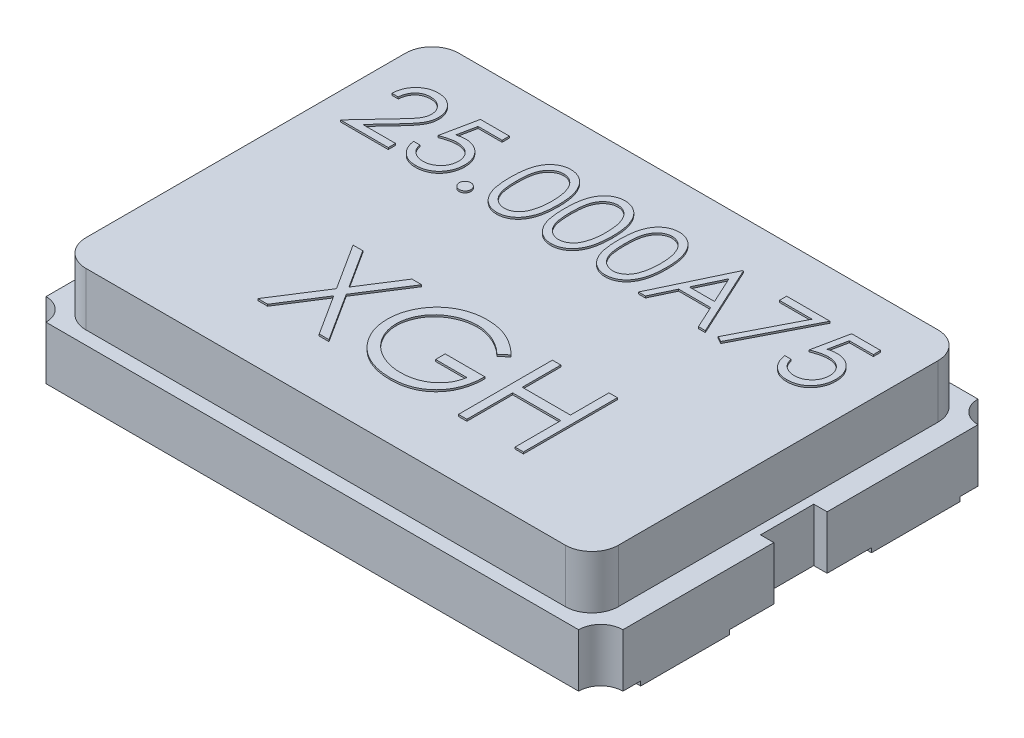
from build123d import *

# Parameters (mm, degrees)
EXTRUDE1_DEPTH = 0.6
EXTRUDE2_DEPTH = 0.6
SKETCH3_W      = 1
SKETCH3_H      = 1
EXTRUDE3_DEPTH = 0.05
EXTRUDE4_DEPTH = 0.02
EXTRUDE5_DEPTH = 0.02


with BuildPart() as part:
    # Sketch1 → Extrude1 (new body)
    with BuildSketch(Plane(origin=(0, 0, 0), x_dir=(1, 0, 0), z_dir=(0, 1, 0))):
        with BuildLine():
            Line((-3.25, 2), (-3.25, 0.3))
            Line((-3.25, 0.3), (-3.1, 0.3))
            Line((-3.1, 0.3), (-3.1, -0.3))
            Line((-3.1, -0.3), (-3.25, -0.3))
            Line((-3.25, -0.3), (-3.25, -2))
            ThreePointArc((-3.25, -2), (-3.073223305, -2.073223305), (-3, -2.25))
            Line((-3, -2.25), (3, -2.25))
            ThreePointArc((3, -2.25), (3.073223305, -2.073223305), (3.25, -2))
            Line((3.25, -2), (3.25, -0.3))
            Line((3.25, -0.3), (3.1, -0.3))
            Line((3.1, -0.3), (3.1, 0.3))
            Line((3.1, 0.3), (3.25, 0.3))
            Line((3.25, 0.3), (3.25, 2))
            ThreePointArc((3.25, 2), (3.073223305, 2.073223305), (3, 2.25))
            Line((3, 2.25), (-3, 2.25))
            ThreePointArc((-3, 2.25), (-3.073223305, 2.073223305), (-3.25, 2))
        make_face()
    extrude(amount=EXTRUDE1_DEPTH)

    # Sketch2 → Extrude2 (add)
    with BuildSketch(Plane(origin=(0, 0.6, 0), x_dir=(1, 0, 0), z_dir=(0, 1, 0))):
        with BuildLine():
            Line((-2.7, 2.1), (2.7, 2.1))
            ThreePointArc((2.7, 2.1), (2.912132034, 2.012132034), (3, 1.8))
            Line((3, 1.8), (3, -1.8))
            ThreePointArc((3, -1.8), (2.912132034, -2.012132034), (2.7, -2.1))
            Line((2.7, -2.1), (-2.7, -2.1))
            ThreePointArc((-2.7, -2.1), (-2.912132034, -2.012132034), (-3, -1.8))
            Line((-3, -1.8), (-3, 1.8))
            ThreePointArc((-3, 1.8), (-2.912132034, 2.012132034), (-2.7, 2.1))
        make_face()
    extrude(amount=EXTRUDE2_DEPTH)

    # Sketch3 → Extrude3 (add)
    with BuildSketch(Plane.XZ):
        with Locations((-2.75, 1.3)):
            Rectangle(SKETCH3_W, SKETCH3_H)
        with Locations((-2.75, -1.3)):
            Rectangle(SKETCH3_W, SKETCH3_H)
        with Locations((2.75, 1.3)):
            Rectangle(SKETCH3_W, SKETCH3_H)
        with Locations((2.75, -1.3)):
            Rectangle(SKETCH3_W, SKETCH3_H)
    extrude(amount=EXTRUDE3_DEPTH)

    # Sketch4 → Extrude4 (add)
    # profile 1 of 9: a face of its own
    with BuildSketch(Plane(origin=(0, 1.2, 0), x_dir=(1, 0, 0), z_dir=(0, 1, 0))):
        with BuildLine():
            Line((-2.593557402, 1.311680884), (-2.664791376, 1.311680884))
            add(Edge.make_bspline(
                [(-2.664791376, 1.311680884), (-2.664327111, 1.321131246), (-2.663415307, 1.339691506), (-2.65914532, 1.366752463), (-2.653035514, 1.392618462), (-2.644396916, 1.417081817), (-2.633668528, 1.440358833), (-2.620802968, 1.46235705), (-2.605564363, 1.482992552), (-2.588281764, 1.50207404), (-2.569511019, 1.519579078), (-2.549257708, 1.534695535), (-2.527974996, 1.547467578), (-2.505727454, 1.558144932), (-2.482264076, 1.566159504), (-2.457797785, 1.572106197), (-2.432221088, 1.575684047), (-2.414794869, 1.576068627), (-2.405932201, 1.576264217)],
                knots=[0, 0, 0, 0, 1.10065271, 2.161652631, 3.183658789, 4.190468796, 5.17591951, 6.163126047, 7.15150782, 8.156236427, 9.156009102, 10.134482811, 11.092018607, 12.041330605, 13.001268258, 13.972401359, 14.968799086, 16, 16, 16, 16], degree=3))
            add(Edge.make_bspline(
                [(-2.405932201, 1.576264217), (-2.397228602, 1.57606046), (-2.380126341, 1.575660085), (-2.355165849, 1.57222178), (-2.331403855, 1.566836619), (-2.308886808, 1.559281159), (-2.287794361, 1.54912469), (-2.267968064, 1.536924177), (-2.24917188, 1.522813608), (-2.232252127, 1.50620069), (-2.216715473, 1.488465506), (-2.203311926, 1.469531642), (-2.191833584, 1.449976072), (-2.182266021, 1.429649676), (-2.175222932, 1.408361068), (-2.169875731, 1.386420185), (-2.166853264, 1.363599915), (-2.166389391, 1.348154321), (-2.166153555, 1.340301677)],
                knots=[0, 0, 0, 0, 1.111607364, 2.184268762, 3.212621178, 4.221274766, 5.211760367, 6.196651075, 7.1921475, 8.207485113, 9.220403448, 10.201281604, 11.166441695, 12.114753415, 13.065576456, 14.026450734, 14.996634279, 16, 16, 16, 16], degree=3))
            add(Edge.make_bspline(
                [(-2.166153555, 1.340301677), (-2.166537563, 1.329246365), (-2.16729884, 1.307329745), (-2.17381085, 1.275122803), (-2.183981399, 1.243918581), (-2.196227228, 1.218804943), (-2.2085808, 1.198568061), (-2.219713145, 1.181906408), (-2.232745344, 1.163966418), (-2.247867074, 1.144808165), (-2.264765529, 1.124281585), (-2.28359377, 1.102399078), (-2.30448606, 1.07938673), (-2.319149684, 1.06366921), (-2.326748007, 1.055524784)],
                knots=[0, 0, 0, 0, 1.184426356, 2.348067706, 3.509069118, 4.696110526, 5.333549288, 6.050745305, 6.844228056, 7.710549037, 8.667450064, 9.695053472, 10.805634456, 12, 12, 12, 12], degree=3))
            Line((-2.326748007, 1.055524784), (-2.525344511, 0.84357191))
            Line((-2.525344511, 0.84357191), (-2.155977273, 0.84357191))
            Line((-2.155977273, 0.84357191), (-2.155977273, 0.762161653))
            Line((-2.155977273, 0.762161653), (-2.695320222, 0.762161653))
            Line((-2.695320222, 0.762161653), (-2.38748769, 1.090664758))
            add(Edge.make_bspline(
                [(-2.38748769, 1.090664758), (-2.379992901, 1.098488481), (-2.365596946, 1.113516252), (-2.345235541, 1.135456174), (-2.32694777, 1.155810087), (-2.310615254, 1.174539537), (-2.296592298, 1.191918481), (-2.28414806, 1.207384066), (-2.274177292, 1.221615879), (-2.263356122, 1.238112411), (-2.252875451, 1.258253776), (-2.243869256, 1.282867666), (-2.238377675, 1.308205811), (-2.237718899, 1.325328594), (-2.23738753, 1.333941501)],
                knots=[0, 0, 0, 0, 1.329631726, 2.553950428, 3.673215718, 4.687767853, 5.603093632, 6.413772471, 7.123043292, 7.734684054, 8.834405432, 9.900288307, 10.943827018, 12, 12, 12, 12], degree=3))
            add(Edge.make_bspline(
                [(-2.23738753, 1.333941501), (-2.237531707, 1.339357461), (-2.237815853, 1.350031278), (-2.240323581, 1.365680798), (-2.244113285, 1.380776747), (-2.249543727, 1.395365559), (-2.256711684, 1.409300555), (-2.265436897, 1.422598698), (-2.275503929, 1.435454946), (-2.287149664, 1.447509354), (-2.299942991, 1.458549556), (-2.313458115, 1.468329483), (-2.327756978, 1.476502638), (-2.342779291, 1.483202681), (-2.358483175, 1.488458527), (-2.374899001, 1.492100383), (-2.391981412, 1.494386946), (-2.403645794, 1.494696321), (-2.409589303, 1.494853961)],
                knots=[0, 0, 0, 0, 0.991446411, 1.95395049, 2.89581595, 3.838931463, 4.798493298, 5.75982156, 6.748411868, 7.785213223, 8.824556874, 9.840280684, 10.836137867, 11.835679398, 12.848801643, 13.863922112, 14.911575587, 16, 16, 16, 16], degree=3))
            add(Edge.make_bspline(
                [(-2.409589303, 1.494853961), (-2.415796616, 1.494691802), (-2.427986756, 1.494373348), (-2.445884465, 1.492145708), (-2.462958204, 1.488302634), (-2.479250921, 1.483046495), (-2.494790185, 1.476365717), (-2.509500423, 1.468044554), (-2.523348614, 1.458115083), (-2.53636079, 1.446857314), (-2.548349585, 1.434323411), (-2.558883073, 1.420351152), (-2.568086948, 1.405195649), (-2.576117256, 1.388897795), (-2.582638636, 1.371309706), (-2.587621832, 1.352493816), (-2.591564921, 1.332531824), (-2.59288221, 1.318746635), (-2.593557402, 1.311680884)],
                knots=[0, 0, 0, 0, 1.031018746, 2.02475058, 2.990194455, 3.934040569, 4.864654155, 5.795059489, 6.735614925, 7.690564532, 8.649604399, 9.611025574, 10.590972636, 11.591080095, 12.624614302, 13.701020113, 14.821632451, 16, 16, 16, 16], degree=3))
        make_face()
    # profile 2 of 9: a face of its own
    with BuildSketch(Plane(origin=(0, 1.2, 0), x_dir=(1, 0, 0), z_dir=(0, 1, 0))):
        with BuildLine():
            Line((-1.586105478, 1.555911653), (-1.586105478, 1.474501397))
            Line((-1.586105478, 1.474501397), (-1.856094962, 1.474501397))
            Line((-1.856094962, 1.474501397), (-1.898867147, 1.26572861))
            add(Edge.make_bspline(
                [(-1.898867147, 1.26572861), (-1.890463404, 1.26804869), (-1.874182481, 1.272543477), (-1.850152299, 1.277534071), (-1.827339424, 1.280542485), (-1.812535902, 1.280953264), (-1.805372556, 1.281152038)],
                knots=[0, 0, 0, 0, 1.100273476, 2.13160584, 3.095893838, 4, 4, 4, 4], degree=3))
            add(Edge.make_bspline(
                [(-1.805372556, 1.281152038), (-1.796508922, 1.280960192), (-1.779080803, 1.280582974), (-1.753581256, 1.276960787), (-1.72923969, 1.271259414), (-1.706107009, 1.263294581), (-1.68414042, 1.253109695), (-1.663542027, 1.24038703), (-1.644002643, 1.225525007), (-1.625872804, 1.208437834), (-1.609425327, 1.189632396), (-1.594964112, 1.169412665), (-1.58268081, 1.147975141), (-1.572801853, 1.125115003), (-1.564913263, 1.101084981), (-1.559662722, 1.075632235), (-1.556166432, 1.048996679), (-1.55577582, 1.03078475), (-1.555576632, 1.021497841)],
                knots=[0, 0, 0, 0, 1.052922333, 2.070308379, 3.05430497, 4.020497103, 4.973039431, 5.925935799, 6.892292201, 7.88610001, 8.88166317, 9.857072816, 10.836096531, 11.812156883, 12.81219415, 13.836441305, 14.89672472, 16, 16, 16, 16], degree=3))
            add(Edge.make_bspline(
                [(-1.555576632, 1.021497841), (-1.555727462, 1.015029409), (-1.556027083, 1.00217996), (-1.557550762, 0.983097257), (-1.560484398, 0.964418543), (-1.56442315, 0.94614134), (-1.569535448, 0.928300251), (-1.575724216, 0.910844208), (-1.583297958, 0.893881859), (-1.59160543, 0.877252707), (-1.600959542, 0.861332689), (-1.611341454, 0.846444436), (-1.622310056, 0.832364608), (-1.634112299, 0.819244208), (-1.646857882, 0.807169452), (-1.660392446, 0.796068681), (-1.674607991, 0.785754165), (-1.689724448, 0.776644592), (-1.705404975, 0.768261922), (-1.721876017, 0.761384977), (-1.73876264, 0.755236696), (-1.756307889, 0.750335964), (-1.774472021, 0.746495903), (-1.793284979, 0.743887731), (-1.812648096, 0.741988075), (-1.825773322, 0.741869158), (-1.832403305, 0.741809089)],
                knots=[0, 0, 0, 0, 1.056347294, 2.098418968, 3.122841568, 4.141288669, 5.149314143, 6.15115421, 7.162517403, 8.180376062, 9.185164535, 10.17417709, 11.141909838, 12.097768115, 13.052685741, 14.0056014, 14.954263652, 15.917497458, 16.885230207, 17.854509472, 18.828990115, 19.81800267, 20.826176721, 21.857883937, 22.917946725, 24, 24, 24, 24], degree=3))
            add(Edge.make_bspline(
                [(-1.832403305, 0.741809089), (-1.840312271, 0.741965761), (-1.855872227, 0.742273995), (-1.878668856, 0.745498545), (-1.900602347, 0.75011679), (-1.921496138, 0.757064658), (-1.941537478, 0.765770348), (-1.960456558, 0.776773123), (-1.978736797, 0.789241598), (-1.995635062, 0.803955535), (-2.011318681, 0.820038199), (-2.025358193, 0.837491093), (-2.0378617, 0.856026163), (-2.048628975, 0.875733423), (-2.057813348, 0.896561089), (-2.065028533, 0.918587199), (-2.070852017, 0.941696664), (-2.073315685, 0.957606478), (-2.074567017, 0.965687294)],
                knots=[0, 0, 0, 0, 1.0467383, 2.05933395, 3.04377827, 4.011590433, 4.970194871, 5.932262533, 6.905835911, 7.896367577, 8.894135286, 9.877477877, 10.858688626, 11.851381753, 12.8477658, 13.868841284, 14.917554742, 16, 16, 16, 16], degree=3))
            Line((-2.074567017, 0.965687294), (-2.003333043, 0.965687294))
            add(Edge.make_bspline(
                [(-2.003333043, 0.965687294), (-2.001580316, 0.958117992), (-1.998211479, 0.943569372), (-1.990816961, 0.923128871), (-1.98177595, 0.904913619), (-1.971025321, 0.88868266), (-1.958200582, 0.874529191), (-1.943566229, 0.861916035), (-1.927158799, 0.850537033), (-1.908926763, 0.841052227), (-1.889692368, 0.832963063), (-1.869561233, 0.827576518), (-1.849081497, 0.823788994), (-1.835229795, 0.823409863), (-1.82826919, 0.823219346)],
                knots=[0, 0, 0, 0, 1.136247022, 2.183929868, 3.172523383, 4.106158343, 5.02341133, 5.958108904, 6.928429099, 7.938127109, 8.96079061, 9.975095812, 10.982467395, 12, 12, 12, 12], degree=3))
            add(Edge.make_bspline(
                [(-1.82826919, 0.823219346), (-1.821475043, 0.823405486), (-1.808097312, 0.823771999), (-1.788409729, 0.826592989), (-1.769402167, 0.830937653), (-1.751262177, 0.837439566), (-1.733672328, 0.84534185), (-1.717077562, 0.855482591), (-1.700997802, 0.867152988), (-1.685932851, 0.880523509), (-1.672135333, 0.895257708), (-1.659944212, 0.911014188), (-1.649789448, 0.92782283), (-1.641231891, 0.945392635), (-1.634733732, 0.963916164), (-1.63009801, 0.98330661), (-1.627375888, 1.003611864), (-1.627001424, 1.017461511), (-1.626810607, 1.024518925)],
                knots=[0, 0, 0, 0, 1.027316725, 2.022795036, 3.002884548, 3.971462791, 4.93288096, 5.914575861, 6.907176829, 7.935150275, 8.956128384, 9.956726525, 10.942570165, 11.921478529, 12.907843606, 13.90538589, 14.932640048, 16, 16, 16, 16], degree=3))
            add(Edge.make_bspline(
                [(-1.626810607, 1.024518925), (-1.62695994, 1.030886104), (-1.62725224, 1.043348952), (-1.629640423, 1.061582343), (-1.633794451, 1.078834623), (-1.639560223, 1.095189101), (-1.646880755, 1.110661203), (-1.655826615, 1.125266897), (-1.666565689, 1.138813677), (-1.678832956, 1.151307881), (-1.692271834, 1.162838772), (-1.707113539, 1.172668592), (-1.723047487, 1.180938087), (-1.7398817, 1.18807458), (-1.758016597, 1.193200106), (-1.777093047, 1.19704818), (-1.79731705, 1.199274164), (-1.811144332, 1.199583021), (-1.818251913, 1.199741781)],
                knots=[0, 0, 0, 0, 1.045622112, 2.046656509, 3.013763289, 3.955457236, 4.890082067, 5.820317437, 6.762574623, 7.722996705, 8.69280354, 9.665887285, 10.63943826, 11.638615906, 12.663482002, 13.728887084, 14.832589034, 16, 16, 16, 16], degree=3))
            add(Edge.make_bspline(
                [(-1.818251913, 1.199741781), (-1.824404366, 1.199610112), (-1.837107622, 1.199338247), (-1.856593691, 1.197336524), (-1.877070564, 1.194107255), (-1.898459745, 1.189665374), (-1.920825467, 1.183852612), (-1.944120533, 1.176887002), (-1.968393922, 1.168558977), (-1.984749192, 1.162269707), (-1.993156761, 1.159036653)],
                knots=[0, 0, 0, 0, 0.817624296, 1.688186739, 2.600797293, 3.572016777, 4.590301741, 5.671205678, 6.80286297, 8, 8, 8, 8], degree=3))
            Line((-1.993156761, 1.159036653), (-1.911746504, 1.555911653))
            Line((-1.911746504, 1.555911653), (-1.586105478, 1.555911653))
        make_face()
    # profile 3 of 9: a face of its own
    with BuildSketch(Plane(origin=(0, 1.2, 0), x_dir=(1, 0, 0), z_dir=(0, 1, 0))):
        with BuildLine():
            add(Edge.make_bspline(
                [(-1.34696285, 0.884277038), (-1.342542749, 0.884014382), (-1.333877656, 0.883499476), (-1.321350211, 0.879966909), (-1.310012136, 0.87369432), (-1.299912859, 0.865334369), (-1.291588355, 0.855198031), (-1.285092225, 0.843950387), (-1.28159043, 0.831318062), (-1.281079275, 0.822602761), (-1.280817017, 0.818131205)],
                knots=[0, 0, 0, 0, 1.020151414, 1.999887582, 2.974338812, 3.990962822, 5.007586832, 5.987933904, 6.967670073, 8, 8, 8, 8], degree=3))
            add(Edge.make_bspline(
                [(-1.280817017, 0.818131205), (-1.281088162, 0.813767092), (-1.281622856, 0.805161127), (-1.285084198, 0.792624081), (-1.291637863, 0.781369408), (-1.299855442, 0.77109553), (-1.310014633, 0.762717868), (-1.321377016, 0.756498646), (-1.333848248, 0.752713143), (-1.342537842, 0.752230929), (-1.34696285, 0.751985371)],
                knots=[0, 0, 0, 0, 1.009421747, 1.99056486, 2.972319754, 3.999869655, 5.017953583, 5.993804169, 6.978383603, 8, 8, 8, 8], degree=3))
            add(Edge.make_bspline(
                [(-1.34696285, 0.751985371), (-1.351391047, 0.752222044), (-1.360036046, 0.752684092), (-1.372460727, 0.756576371), (-1.383892307, 0.762659549), (-1.394049521, 0.771111151), (-1.402335924, 0.781316541), (-1.408600966, 0.792701591), (-1.412363375, 0.805125239), (-1.412858192, 0.813760024), (-1.413108684, 0.818131205)],
                knots=[0, 0, 0, 0, 1.022052826, 1.995314843, 2.982371812, 4.00089066, 5.028879526, 6.005146991, 6.990147033, 8, 8, 8, 8], degree=3))
            add(Edge.make_bspline(
                [(-1.413108684, 0.818131205), (-1.412867815, 0.822610082), (-1.412397548, 0.83135454), (-1.408593068, 0.843872909), (-1.402384534, 0.855250394), (-1.393992239, 0.865318904), (-1.383894765, 0.873752453), (-1.372488304, 0.879890362), (-1.360006122, 0.883528098), (-1.351386011, 0.884023062), (-1.34696285, 0.884277038)],
                knots=[0, 0, 0, 0, 1.032775665, 2.016367738, 2.991239715, 4.008302682, 5.025365648, 6.011011707, 6.979408107, 8, 8, 8, 8], degree=3))
        make_face()
    # profile 4 of 9: a face of its own
    with BuildSketch(Plane(origin=(0, 1.2, 0), x_dir=(1, 0, 0), z_dir=(0, 1, 0))):
        with BuildLine():
            add(Edge.make_bspline(
                [(-1.179054196, 1.158718644), (-1.178979807, 1.171440731), (-1.178835303, 1.196153566), (-1.177227751, 1.232163655), (-1.174557271, 1.26594572), (-1.170897546, 1.29750138), (-1.166443932, 1.32683878), (-1.160498634, 1.35387952), (-1.153737517, 1.378748752), (-1.145901516, 1.401527574), (-1.137059642, 1.422522874), (-1.127436158, 1.442122875), (-1.116649142, 1.46029792), (-1.105315092, 1.477338098), (-1.092975212, 1.492964472), (-1.079980664, 1.507397718), (-1.065824275, 1.520304263), (-1.050987271, 1.532062264), (-1.035335323, 1.542369555), (-1.019314575, 1.551448408), (-1.002814757, 1.55920445), (-0.985790819, 1.565302816), (-0.968395774, 1.570339919), (-0.950568815, 1.573784555), (-0.932280505, 1.575951926), (-0.919936233, 1.576159133), (-0.913675841, 1.576264217)],
                knots=[0, 0, 0, 0, 1.646270934, 3.197905019, 4.663502075, 6.030701355, 7.308322542, 8.50163776, 9.611534131, 10.641858119, 11.616356847, 12.558055219, 13.465016945, 14.349605745, 15.204443733, 16.039544428, 16.859896111, 17.680448484, 18.487036065, 19.28249412, 20.06191084, 20.843045899, 21.620316918, 22.403196591, 23.190181807, 24, 24, 24, 24], degree=3))
            add(Edge.make_bspline(
                [(-0.913675841, 1.576264217), (-0.907363152, 1.576153588), (-0.8948092, 1.575933581), (-0.876248972, 1.573819044), (-0.858117527, 1.570310414), (-0.840492163, 1.56533905), (-0.823228104, 1.559171459), (-0.806460382, 1.551440988), (-0.790084848, 1.542442388), (-0.774361729, 1.531868758), (-0.759118415, 1.520079921), (-0.744729323, 1.506753387), (-0.731193145, 1.492023718), (-0.718339995, 1.47604851), (-0.706534529, 1.458521357), (-0.695291983, 1.439747103), (-0.685229039, 1.419397425), (-0.675537425, 1.397811855), (-0.667171984, 1.374393132), (-0.659627674, 1.349273267), (-0.653531908, 1.322155549), (-0.648454341, 1.293182258), (-0.644520767, 1.262246989), (-0.641655864, 1.229416057), (-0.640142503, 1.194667861), (-0.639857502, 1.170910278), (-0.639711248, 1.158718644)],
                knots=[0, 0, 0, 0, 0.810914788, 1.612654377, 2.396697861, 3.181598691, 3.963628158, 4.749916497, 5.551656086, 6.361998678, 7.18212741, 8.025565596, 8.878627764, 9.750805457, 10.657531673, 11.591944965, 12.560506719, 13.57287815, 14.630710178, 15.753379473, 16.941251878, 18.199788006, 19.531962791, 20.947069417, 22.433333509, 24, 24, 24, 24], degree=3))
            add(Edge.make_bspline(
                [(-0.639711248, 1.158718644), (-0.639859018, 1.146580187), (-0.640146942, 1.122928897), (-0.641638898, 1.088337051), (-0.644577731, 1.055680352), (-0.648253925, 1.024880479), (-0.653345482, 0.996065626), (-0.65960594, 0.969136081), (-0.666556995, 0.943975551), (-0.675137386, 0.920790156), (-0.684528743, 0.899256462), (-0.694746618, 0.879148019), (-0.705693525, 0.860287092), (-0.717619901, 0.84282465), (-0.730332015, 0.82663699), (-0.744101942, 0.81200985), (-0.758541521, 0.798590787), (-0.773829694, 0.78665015), (-0.789798028, 0.776198775), (-0.806117318, 0.766852063), (-0.823077121, 0.759315362), (-0.840293095, 0.752844022), (-0.858011492, 0.747899991), (-0.876210227, 0.744481456), (-0.89479673, 0.742083912), (-0.907361014, 0.741901014), (-0.913675841, 0.741809089)],
                knots=[0, 0, 0, 0, 1.561518951, 3.042555995, 4.452378317, 5.7783523, 7.031515105, 8.214008947, 9.334062868, 10.386615937, 11.391082383, 12.354592575, 13.286541444, 14.194233754, 15.072674879, 15.931287219, 16.775624067, 17.606195743, 18.42308326, 19.229000347, 20.022332153, 20.807536673, 21.593273796, 22.3848459, 23.188221202, 24, 24, 24, 24], degree=3))
            add(Edge.make_bspline(
                [(-0.913675841, 0.741809089), (-0.91993606, 0.741914852), (-0.932279989, 0.742123395), (-0.950570807, 0.744280974), (-0.968324147, 0.747749775), (-0.985627614, 0.752606755), (-1.002569985, 0.758551906), (-1.018920393, 0.766297473), (-1.034860635, 0.775217878), (-1.050348184, 0.78537684), (-1.065092014, 0.797015864), (-1.07917509, 0.809889194), (-1.092243622, 0.824318075), (-1.104407068, 0.840074675), (-1.115967263, 0.857014036), (-1.126601103, 0.875367434), (-1.136436993, 0.895062098), (-1.145427571, 0.916225267), (-1.153398785, 0.93916576), (-1.160439962, 0.96414602), (-1.165999423, 0.99138653), (-1.170758057, 1.020668504), (-1.174596266, 1.052117771), (-1.177216622, 1.085751402), (-1.17883617, 1.121548441), (-1.178980195, 1.146102479), (-1.179054196, 1.158718644)],
                knots=[0, 0, 0, 0, 0.810891512, 1.598919785, 2.382837074, 3.152667961, 3.926044502, 4.706494248, 5.493654104, 6.291793342, 7.103789334, 7.925228297, 8.761435821, 9.622817696, 10.50288917, 11.416980706, 12.369136599, 13.353924996, 14.394355917, 15.514179734, 16.714354668, 17.994756427, 19.357759367, 20.818452758, 22.365282078, 24, 24, 24, 24], degree=3))
        make_face()
        with BuildLine():
            add(Edge.make_bspline(
                [(-1.107820222, 1.159036653), (-1.107793133, 1.148434716), (-1.107740559, 1.127858438), (-1.106367099, 1.09795827), (-1.104496064, 1.070070356), (-1.10208277, 1.044159286), (-1.098498887, 1.020312766), (-1.094483241, 0.998366784), (-1.089596442, 0.978437482), (-1.083814536, 0.960388103), (-1.077228884, 0.943912333), (-1.070038447, 0.928581343), (-1.062313961, 0.914214029), (-1.053669083, 0.900939442), (-1.044254059, 0.888714294), (-1.034281552, 0.877322206), (-1.023379377, 0.86716289), (-1.008297278, 0.854978407), (-0.988386292, 0.842387461), (-0.963299153, 0.831423258), (-0.937520772, 0.824532951), (-0.920023971, 0.823656706), (-0.911290775, 0.823219346)],
                knots=[0, 0, 0, 0, 1.459021318, 2.831673884, 4.118529203, 5.306027144, 6.411944654, 7.436330062, 8.375795394, 9.233974572, 10.042671642, 10.816086306, 11.563610507, 12.285937304, 12.993564865, 13.685989202, 14.367179055, 15.041617293, 16.353048772, 17.594441528, 18.799311195, 20, 20, 20, 20], degree=3))
            add(Edge.make_bspline(
                [(-0.911290775, 0.823219346), (-0.902501089, 0.823581699), (-0.884939864, 0.824305659), (-0.859282735, 0.831290373), (-0.834374799, 0.841829), (-0.814854912, 0.85429031), (-0.800004407, 0.866157627), (-0.789364304, 0.876275592), (-0.779598446, 0.887604869), (-0.770336047, 0.899828459), (-0.761840864, 0.913179898), (-0.754115831, 0.927594982), (-0.747066572, 0.943113742), (-0.743050413, 0.953947236), (-0.740997055, 0.959486122)],
                knots=[0, 0, 0, 0, 1.353760809, 2.704726607, 4.075137775, 5.516104923, 6.260822281, 7.007110065, 7.778089737, 8.566572457, 9.372053459, 10.217411131, 11.088608312, 12, 12, 12, 12], degree=3))
            add(Edge.make_bspline(
                [(-0.740997055, 0.959486122), (-0.738604065, 0.966568581), (-0.733745268, 0.98094901), (-0.727483313, 1.003256481), (-0.722551767, 1.026661393), (-0.718115075, 1.051023875), (-0.715086792, 1.076523593), (-0.712649342, 1.103081648), (-0.711213633, 1.130718064), (-0.711035662, 1.149494785), (-0.710945222, 1.159036653)],
                knots=[0, 0, 0, 0, 0.884706709, 1.796334032, 2.740027952, 3.714592787, 4.726048262, 5.777819803, 6.87074269, 8, 8, 8, 8], degree=3))
            add(Edge.make_bspline(
                [(-0.710945222, 1.159036653), (-0.711069997, 1.168576978), (-0.711314084, 1.187239892), (-0.712247077, 1.214571694), (-0.714656352, 1.240531346), (-0.717332224, 1.265230686), (-0.721277665, 1.288532987), (-0.725531668, 1.310633324), (-0.731246943, 1.331257903), (-0.737351963, 1.350729629), (-0.744339321, 1.368827278), (-0.752030925, 1.385635226), (-0.760245502, 1.401234618), (-0.76916776, 1.415582657), (-0.778691781, 1.428743609), (-0.78906894, 1.440453597), (-0.79988761, 1.451075552), (-0.815040793, 1.463200099), (-0.834878713, 1.475562573), (-0.85956335, 1.486939451), (-0.885251514, 1.49347276), (-0.90261728, 1.494393893), (-0.911290775, 1.494853961)],
                knots=[0, 0, 0, 0, 1.31362396, 2.569729283, 3.763502607, 4.902122613, 5.988968491, 7.01645872, 7.998833611, 8.933434873, 9.825090667, 10.667526885, 11.477055099, 12.250526234, 12.991942729, 13.710640831, 14.402115721, 15.076753259, 16.378508321, 17.609869233, 18.806226677, 20, 20, 20, 20], degree=3))
            add(Edge.make_bspline(
                [(-0.911290775, 1.494853961), (-0.920069784, 1.494393258), (-0.937643796, 1.493471012), (-0.963598957, 1.486963792), (-0.988478337, 1.475621566), (-1.008263797, 1.463159153), (-1.023427549, 1.451289572), (-1.034105231, 1.440996572), (-1.044116952, 1.429737511), (-1.053339806, 1.417399934), (-1.061977911, 1.404140824), (-1.069911105, 1.389855872), (-1.077058785, 1.374472688), (-1.083654742, 1.358004317), (-1.089454285, 1.339956496), (-1.094238095, 1.320051742), (-1.09865748, 1.298175563), (-1.10178605, 1.274199889), (-1.104567295, 1.248282329), (-1.106354672, 1.220324795), (-1.107745153, 1.19037448), (-1.107794698, 1.169691813), (-1.107820222, 1.159036653)],
                knots=[0, 0, 0, 0, 1.207732386, 2.417664972, 3.655092373, 4.956220595, 5.625982001, 6.301752483, 6.994047911, 7.697131622, 8.419323945, 9.170223765, 9.943494443, 10.752040957, 11.610060368, 12.549350801, 13.567764191, 14.679664412, 15.874934091, 17.154273443, 18.533957287, 20, 20, 20, 20], degree=3))
        make_face(mode=Mode.SUBTRACT)
    # profile 5 of 9: a face of its own
    with BuildSketch(Plane(origin=(0, 1.2, 0), x_dir=(1, 0, 0), z_dir=(0, 1, 0))):
        with BuildLine():
            add(Edge.make_bspline(
                [(-0.568477273, 1.158718644), (-0.568402884, 1.171440731), (-0.56825838, 1.196153566), (-0.566650828, 1.232163655), (-0.563980348, 1.26594572), (-0.560320623, 1.29750138), (-0.555867009, 1.32683878), (-0.549921711, 1.35387952), (-0.543160594, 1.378748752), (-0.535324592, 1.401527574), (-0.526482719, 1.422522874), (-0.516859235, 1.442122875), (-0.506072219, 1.46029792), (-0.494738169, 1.477338098), (-0.482398288, 1.492964472), (-0.469403741, 1.507397718), (-0.455247352, 1.520304263), (-0.440410348, 1.532062264), (-0.4247584, 1.542369555), (-0.408737652, 1.551448408), (-0.392237834, 1.55920445), (-0.375213896, 1.565302816), (-0.357818851, 1.570339919), (-0.339991892, 1.573784555), (-0.321703582, 1.575951926), (-0.30935931, 1.576159133), (-0.303098918, 1.576264217)],
                knots=[0, 0, 0, 0, 1.646270934, 3.197905019, 4.663502075, 6.030701355, 7.308322542, 8.50163776, 9.611534131, 10.641858119, 11.616356847, 12.558055219, 13.465016945, 14.349605745, 15.204443733, 16.039544428, 16.859896111, 17.680448484, 18.487036065, 19.28249412, 20.06191084, 20.843045899, 21.620316918, 22.403196591, 23.190181807, 24, 24, 24, 24], degree=3))
            add(Edge.make_bspline(
                [(-0.303098918, 1.576264217), (-0.296786229, 1.576153588), (-0.284232277, 1.575933581), (-0.265672049, 1.573819044), (-0.247540603, 1.570310414), (-0.22991524, 1.56533905), (-0.21265118, 1.559171459), (-0.195883459, 1.551440988), (-0.179507925, 1.542442388), (-0.163784806, 1.531868758), (-0.148541492, 1.520079921), (-0.1341524, 1.506753387), (-0.120616221, 1.492023718), (-0.107763072, 1.47604851), (-0.095957606, 1.458521357), (-0.08471506, 1.439747103), (-0.074652116, 1.419397425), (-0.064960502, 1.397811855), (-0.056595061, 1.374393132), (-0.049050751, 1.349273267), (-0.042954985, 1.322155549), (-0.037877418, 1.293182258), (-0.033943844, 1.262246989), (-0.031078941, 1.229416057), (-0.02956558, 1.194667861), (-0.029280579, 1.170910278), (-0.029134325, 1.158718644)],
                knots=[0, 0, 0, 0, 0.810914788, 1.612654377, 2.396697861, 3.181598691, 3.963628158, 4.749916497, 5.551656086, 6.361998678, 7.18212741, 8.025565596, 8.878627764, 9.750805457, 10.657531673, 11.591944965, 12.560506719, 13.57287815, 14.630710178, 15.753379473, 16.941251878, 18.199788006, 19.531962791, 20.947069417, 22.433333509, 24, 24, 24, 24], degree=3))
            add(Edge.make_bspline(
                [(-0.029134325, 1.158718644), (-0.029282095, 1.146580187), (-0.029570019, 1.122928897), (-0.031061975, 1.088337051), (-0.034000808, 1.055680352), (-0.037677002, 1.024880479), (-0.042768559, 0.996065626), (-0.049029017, 0.969136081), (-0.055980072, 0.943975551), (-0.064560463, 0.920790156), (-0.07395182, 0.899256462), (-0.084169695, 0.879148019), (-0.095116602, 0.860287092), (-0.107042978, 0.84282465), (-0.119755092, 0.82663699), (-0.133525019, 0.81200985), (-0.147964598, 0.798590787), (-0.163252771, 0.78665015), (-0.179221105, 0.776198775), (-0.195540395, 0.766852063), (-0.212500198, 0.759315362), (-0.229716171, 0.752844022), (-0.247434569, 0.747899991), (-0.265633304, 0.744481456), (-0.284219807, 0.742083912), (-0.296784091, 0.741901014), (-0.303098918, 0.741809089)],
                knots=[0, 0, 0, 0, 1.561518951, 3.042555995, 4.452378317, 5.7783523, 7.031515105, 8.214008947, 9.334062868, 10.386615937, 11.391082383, 12.354592575, 13.286541444, 14.194233754, 15.072674879, 15.931287219, 16.775624067, 17.606195743, 18.42308326, 19.229000347, 20.022332153, 20.807536673, 21.593273796, 22.3848459, 23.188221202, 24, 24, 24, 24], degree=3))
            add(Edge.make_bspline(
                [(-0.303098918, 0.741809089), (-0.309359137, 0.741914852), (-0.321703066, 0.742123395), (-0.339993884, 0.744280974), (-0.357747224, 0.747749775), (-0.375050691, 0.752606755), (-0.391993062, 0.758551906), (-0.40834347, 0.766297473), (-0.424283712, 0.775217878), (-0.439771261, 0.78537684), (-0.454515091, 0.797015864), (-0.468598167, 0.809889194), (-0.481666698, 0.824318075), (-0.493830145, 0.840074675), (-0.50539034, 0.857014036), (-0.51602418, 0.875367434), (-0.52586007, 0.895062098), (-0.534850648, 0.916225267), (-0.542821862, 0.93916576), (-0.549863039, 0.96414602), (-0.5554225, 0.99138653), (-0.560181134, 1.020668504), (-0.564019343, 1.052117771), (-0.566639698, 1.085751402), (-0.568259247, 1.121548441), (-0.568403272, 1.146102479), (-0.568477273, 1.158718644)],
                knots=[0, 0, 0, 0, 0.810891512, 1.598919785, 2.382837074, 3.152667961, 3.926044502, 4.706494248, 5.493654104, 6.291793342, 7.103789334, 7.925228297, 8.761435821, 9.622817696, 10.50288917, 11.416980706, 12.369136599, 13.353924996, 14.394355917, 15.514179734, 16.714354668, 17.994756427, 19.357759367, 20.818452758, 22.365282078, 24, 24, 24, 24], degree=3))
        make_face()
        with BuildLine():
            add(Edge.make_bspline(
                [(-0.497243299, 1.159036653), (-0.49721621, 1.148434716), (-0.497163636, 1.127858438), (-0.495790176, 1.09795827), (-0.493919141, 1.070070356), (-0.491505847, 1.044159286), (-0.487921964, 1.020312766), (-0.483906318, 0.998366784), (-0.479019519, 0.978437482), (-0.473237613, 0.960388103), (-0.466651961, 0.943912333), (-0.459461524, 0.928581343), (-0.451737038, 0.914214029), (-0.44309216, 0.900939442), (-0.433677136, 0.888714294), (-0.423704629, 0.877322206), (-0.412802454, 0.86716289), (-0.397720355, 0.854978407), (-0.377809369, 0.842387461), (-0.35272223, 0.831423258), (-0.326943849, 0.824532951), (-0.309447048, 0.823656706), (-0.300713852, 0.823219346)],
                knots=[0, 0, 0, 0, 1.459021318, 2.831673884, 4.118529203, 5.306027144, 6.411944654, 7.436330062, 8.375795394, 9.233974572, 10.042671642, 10.816086306, 11.563610507, 12.285937304, 12.993564865, 13.685989202, 14.367179055, 15.041617293, 16.353048772, 17.594441528, 18.799311195, 20, 20, 20, 20], degree=3))
            add(Edge.make_bspline(
                [(-0.300713852, 0.823219346), (-0.291924166, 0.823581699), (-0.274362941, 0.824305659), (-0.248705812, 0.831290373), (-0.223797876, 0.841829), (-0.204277989, 0.85429031), (-0.189427484, 0.866157627), (-0.178787381, 0.876275592), (-0.169021523, 0.887604869), (-0.159759124, 0.899828459), (-0.151263941, 0.913179898), (-0.143538908, 0.927594982), (-0.136489649, 0.943113742), (-0.13247349, 0.953947236), (-0.130420132, 0.959486122)],
                knots=[0, 0, 0, 0, 1.353760809, 2.704726607, 4.075137775, 5.516104923, 6.260822281, 7.007110065, 7.778089737, 8.566572457, 9.372053459, 10.217411131, 11.088608312, 12, 12, 12, 12], degree=3))
            add(Edge.make_bspline(
                [(-0.130420132, 0.959486122), (-0.128027142, 0.966568581), (-0.123168345, 0.98094901), (-0.116906389, 1.003256481), (-0.111974844, 1.026661393), (-0.107538152, 1.051023875), (-0.104509869, 1.076523593), (-0.102072419, 1.103081648), (-0.100636709, 1.130718064), (-0.100458739, 1.149494785), (-0.100368299, 1.159036653)],
                knots=[0, 0, 0, 0, 0.884706709, 1.796334032, 2.740027952, 3.714592787, 4.726048262, 5.777819803, 6.87074269, 8, 8, 8, 8], degree=3))
            add(Edge.make_bspline(
                [(-0.100368299, 1.159036653), (-0.100493074, 1.168576978), (-0.100737161, 1.187239892), (-0.101670154, 1.214571694), (-0.104079429, 1.240531346), (-0.106755301, 1.265230686), (-0.110700742, 1.288532987), (-0.114954745, 1.310633324), (-0.12067002, 1.331257903), (-0.12677504, 1.350729629), (-0.133762398, 1.368827278), (-0.141454002, 1.385635226), (-0.149668579, 1.401234618), (-0.158590837, 1.415582657), (-0.168114858, 1.428743609), (-0.178492017, 1.440453597), (-0.189310687, 1.451075552), (-0.20446387, 1.463200099), (-0.224301789, 1.475562573), (-0.248986427, 1.486939451), (-0.274674591, 1.49347276), (-0.292040357, 1.494393893), (-0.300713852, 1.494853961)],
                knots=[0, 0, 0, 0, 1.31362396, 2.569729283, 3.763502607, 4.902122613, 5.988968491, 7.01645872, 7.998833611, 8.933434873, 9.825090667, 10.667526885, 11.477055099, 12.250526234, 12.991942729, 13.710640831, 14.402115721, 15.076753259, 16.378508321, 17.609869233, 18.806226677, 20, 20, 20, 20], degree=3))
            add(Edge.make_bspline(
                [(-0.300713852, 1.494853961), (-0.309492861, 1.494393258), (-0.327066873, 1.493471012), (-0.353022034, 1.486963792), (-0.377901414, 1.475621566), (-0.397686874, 1.463159153), (-0.412850626, 1.451289572), (-0.423528308, 1.440996572), (-0.433540029, 1.429737511), (-0.442762883, 1.417399934), (-0.451400988, 1.404140824), (-0.459334182, 1.389855872), (-0.466481862, 1.374472688), (-0.473077819, 1.358004317), (-0.478877362, 1.339956496), (-0.483661172, 1.320051742), (-0.488080557, 1.298175563), (-0.491209127, 1.274199889), (-0.493990372, 1.248282329), (-0.495777749, 1.220324795), (-0.49716823, 1.19037448), (-0.497217775, 1.169691813), (-0.497243299, 1.159036653)],
                knots=[0, 0, 0, 0, 1.207732386, 2.417664972, 3.655092373, 4.956220595, 5.625982001, 6.301752483, 6.994047911, 7.697131622, 8.419323945, 9.170223765, 9.943494443, 10.752040957, 11.610060368, 12.549350801, 13.567764191, 14.679664412, 15.874934091, 17.154273443, 18.533957287, 20, 20, 20, 20], degree=3))
        make_face(mode=Mode.SUBTRACT)
    # profile 6 of 9: a face of its own
    with BuildSketch(Plane(origin=(0, 1.2, 0), x_dir=(1, 0, 0), z_dir=(0, 1, 0))):
        with BuildLine():
            add(Edge.make_bspline(
                [(0.04209965, 1.158718644), (0.04217404, 1.171440731), (0.042318543, 1.196153566), (0.043926095, 1.232163655), (0.046596575, 1.26594572), (0.050256301, 1.29750138), (0.054709914, 1.32683878), (0.060655212, 1.35387952), (0.067416329, 1.378748752), (0.075252331, 1.401527574), (0.084094204, 1.422522874), (0.093717688, 1.442122875), (0.104504704, 1.46029792), (0.115838754, 1.477338098), (0.128178635, 1.492964472), (0.141173182, 1.507397718), (0.155329572, 1.520304263), (0.170166575, 1.532062264), (0.185818523, 1.542369555), (0.201839271, 1.551448408), (0.21833909, 1.55920445), (0.235363027, 1.565302816), (0.252758072, 1.570339919), (0.270585032, 1.573784555), (0.288873341, 1.575951926), (0.301217613, 1.576159133), (0.307478005, 1.576264217)],
                knots=[0, 0, 0, 0, 1.646270934, 3.197905019, 4.663502075, 6.030701355, 7.308322542, 8.50163776, 9.611534131, 10.641858119, 11.616356847, 12.558055219, 13.465016945, 14.349605745, 15.204443733, 16.039544428, 16.859896111, 17.680448484, 18.487036065, 19.28249412, 20.06191084, 20.843045899, 21.620316918, 22.403196591, 23.190181807, 24, 24, 24, 24], degree=3))
            add(Edge.make_bspline(
                [(0.307478005, 1.576264217), (0.313790694, 1.576153588), (0.326344646, 1.575933581), (0.344904874, 1.573819044), (0.36303632, 1.570310414), (0.380661683, 1.56533905), (0.397925743, 1.559171459), (0.414693464, 1.551440988), (0.431068998, 1.542442388), (0.446792117, 1.531868758), (0.462035432, 1.520079921), (0.476424523, 1.506753387), (0.489960702, 1.492023718), (0.502813851, 1.47604851), (0.514619317, 1.458521357), (0.525861863, 1.439747103), (0.535924807, 1.419397425), (0.545616421, 1.397811855), (0.553981863, 1.374393132), (0.561526172, 1.349273267), (0.567621938, 1.322155549), (0.572699505, 1.293182258), (0.57663308, 1.262246989), (0.579497982, 1.229416057), (0.581011343, 1.194667861), (0.581296345, 1.170910278), (0.581442598, 1.158718644)],
                knots=[0, 0, 0, 0, 0.810914788, 1.612654377, 2.396697861, 3.181598691, 3.963628158, 4.749916497, 5.551656086, 6.361998678, 7.18212741, 8.025565596, 8.878627764, 9.750805457, 10.657531673, 11.591944965, 12.560506719, 13.57287815, 14.630710178, 15.753379473, 16.941251878, 18.199788006, 19.531962791, 20.947069417, 22.433333509, 24, 24, 24, 24], degree=3))
            add(Edge.make_bspline(
                [(0.581442598, 1.158718644), (0.581294828, 1.146580187), (0.581006904, 1.122928897), (0.579514948, 1.088337051), (0.576576115, 1.055680352), (0.572899922, 1.024880479), (0.567808364, 0.996065626), (0.561547906, 0.969136081), (0.554596851, 0.943975551), (0.54601646, 0.920790156), (0.536625103, 0.899256462), (0.526407228, 0.879148019), (0.515460321, 0.860287092), (0.503533945, 0.84282465), (0.490821832, 0.82663699), (0.477051904, 0.81200985), (0.462612325, 0.798590787), (0.447324152, 0.78665015), (0.431355818, 0.776198775), (0.415036528, 0.766852063), (0.398076725, 0.759315362), (0.380860752, 0.752844022), (0.363142354, 0.747899991), (0.344943619, 0.744481456), (0.326357116, 0.742083912), (0.313792832, 0.741901014), (0.307478005, 0.741809089)],
                knots=[0, 0, 0, 0, 1.561518951, 3.042555995, 4.452378317, 5.7783523, 7.031515105, 8.214008947, 9.334062868, 10.386615937, 11.391082383, 12.354592575, 13.286541444, 14.194233754, 15.072674879, 15.931287219, 16.775624067, 17.606195743, 18.42308326, 19.229000347, 20.022332153, 20.807536673, 21.593273796, 22.3848459, 23.188221202, 24, 24, 24, 24], degree=3))
            add(Edge.make_bspline(
                [(0.307478005, 0.741809089), (0.301217786, 0.741914852), (0.288873857, 0.742123395), (0.270583039, 0.744280974), (0.252829699, 0.747749775), (0.235526232, 0.752606755), (0.218583861, 0.758551906), (0.202233454, 0.766297473), (0.186293211, 0.775217878), (0.170805662, 0.78537684), (0.156061832, 0.797015864), (0.141978756, 0.809889194), (0.128910225, 0.824318075), (0.116746778, 0.840074675), (0.105186583, 0.857014036), (0.094552743, 0.875367434), (0.084716853, 0.895062098), (0.075726275, 0.916225267), (0.067755061, 0.93916576), (0.060713884, 0.96414602), (0.055154423, 0.99138653), (0.050395789, 1.020668504), (0.046557581, 1.052117771), (0.043937225, 1.085751402), (0.042317676, 1.121548441), (0.042173651, 1.146102479), (0.04209965, 1.158718644)],
                knots=[0, 0, 0, 0, 0.810891512, 1.598919785, 2.382837074, 3.152667961, 3.926044502, 4.706494248, 5.493654104, 6.291793342, 7.103789334, 7.925228297, 8.761435821, 9.622817696, 10.50288917, 11.416980706, 12.369136599, 13.353924996, 14.394355917, 15.514179734, 16.714354668, 17.994756427, 19.357759367, 20.818452758, 22.365282078, 24, 24, 24, 24], degree=3))
        make_face()
        with BuildLine():
            add(Edge.make_bspline(
                [(0.113333624, 1.159036653), (0.113360713, 1.148434716), (0.113413287, 1.127858438), (0.114786747, 1.09795827), (0.116657782, 1.070070356), (0.119071076, 1.044159286), (0.122654959, 1.020312766), (0.126670605, 0.998366784), (0.131557404, 0.978437482), (0.13733931, 0.960388103), (0.143924962, 0.943912333), (0.151115399, 0.928581343), (0.158839885, 0.914214029), (0.167484764, 0.900939442), (0.176899787, 0.888714294), (0.186872294, 0.877322206), (0.197774469, 0.86716289), (0.212856568, 0.854978407), (0.232767554, 0.842387461), (0.257854693, 0.831423258), (0.283633074, 0.824532951), (0.301129875, 0.823656706), (0.309863071, 0.823219346)],
                knots=[0, 0, 0, 0, 1.459021318, 2.831673884, 4.118529203, 5.306027144, 6.411944654, 7.436330062, 8.375795394, 9.233974572, 10.042671642, 10.816086306, 11.563610507, 12.285937304, 12.993564865, 13.685989202, 14.367179055, 15.041617293, 16.353048772, 17.594441528, 18.799311195, 20, 20, 20, 20], degree=3))
            add(Edge.make_bspline(
                [(0.309863071, 0.823219346), (0.318652757, 0.823581699), (0.336213983, 0.824305659), (0.361871111, 0.831290373), (0.386779047, 0.841829), (0.406298934, 0.85429031), (0.421149439, 0.866157627), (0.431789542, 0.876275592), (0.4415554, 0.887604869), (0.450817799, 0.899828459), (0.459312982, 0.913179898), (0.467038015, 0.927594982), (0.474087274, 0.943113742), (0.478103433, 0.953947236), (0.480156791, 0.959486122)],
                knots=[0, 0, 0, 0, 1.353760809, 2.704726607, 4.075137775, 5.516104923, 6.260822281, 7.007110065, 7.778089737, 8.566572457, 9.372053459, 10.217411131, 11.088608312, 12, 12, 12, 12], degree=3))
            add(Edge.make_bspline(
                [(0.480156791, 0.959486122), (0.482549781, 0.966568581), (0.487408578, 0.98094901), (0.493670534, 1.003256481), (0.49860208, 1.026661393), (0.503038771, 1.051023875), (0.506067054, 1.076523593), (0.508504504, 1.103081648), (0.509940214, 1.130718064), (0.510118184, 1.149494785), (0.510208624, 1.159036653)],
                knots=[0, 0, 0, 0, 0.884706709, 1.796334032, 2.740027952, 3.714592787, 4.726048262, 5.777819803, 6.87074269, 8, 8, 8, 8], degree=3))
            add(Edge.make_bspline(
                [(0.510208624, 1.159036653), (0.510083849, 1.168576978), (0.509839762, 1.187239892), (0.508906769, 1.214571694), (0.506497494, 1.240531346), (0.503821622, 1.265230686), (0.499876181, 1.288532987), (0.495622178, 1.310633324), (0.489906903, 1.331257903), (0.483801883, 1.350729629), (0.476814525, 1.368827278), (0.469122921, 1.385635226), (0.460908344, 1.401234618), (0.451986086, 1.415582657), (0.442462065, 1.428743609), (0.432084906, 1.440453597), (0.421266236, 1.451075552), (0.406113053, 1.463200099), (0.386275134, 1.475562573), (0.361590496, 1.486939451), (0.335902332, 1.49347276), (0.318536566, 1.494393893), (0.309863071, 1.494853961)],
                knots=[0, 0, 0, 0, 1.31362396, 2.569729283, 3.763502607, 4.902122613, 5.988968491, 7.01645872, 7.998833611, 8.933434873, 9.825090667, 10.667526885, 11.477055099, 12.250526234, 12.991942729, 13.710640831, 14.402115721, 15.076753259, 16.378508321, 17.609869233, 18.806226677, 20, 20, 20, 20], degree=3))
            add(Edge.make_bspline(
                [(0.309863071, 1.494853961), (0.301084062, 1.494393258), (0.28351005, 1.493471012), (0.257554889, 1.486963792), (0.232675509, 1.475621566), (0.212890049, 1.463159153), (0.197726297, 1.451289572), (0.187048615, 1.440996572), (0.177036894, 1.429737511), (0.16781404, 1.417399934), (0.159175935, 1.404140824), (0.151242741, 1.389855872), (0.144095061, 1.374472688), (0.137499104, 1.358004317), (0.131699561, 1.339956496), (0.126915751, 1.320051742), (0.122496366, 1.298175563), (0.119367796, 1.274199889), (0.116586551, 1.248282329), (0.114799174, 1.220324795), (0.113408693, 1.19037448), (0.113359148, 1.169691813), (0.113333624, 1.159036653)],
                knots=[0, 0, 0, 0, 1.207732386, 2.417664972, 3.655092373, 4.956220595, 5.625982001, 6.301752483, 6.994047911, 7.697131622, 8.419323945, 9.170223765, 9.943494443, 10.752040957, 11.610060368, 12.549350801, 13.567764191, 14.679664412, 15.874934091, 17.154273443, 18.533957287, 20, 20, 20, 20], degree=3))
        make_face(mode=Mode.SUBTRACT)
    # profile 7 of 9: a face of its own
    with BuildSketch(Plane(origin=(0, 1.2, 0), x_dir=(1, 0, 0), z_dir=(0, 1, 0))):
        Polygon((1.049551573, 1.555911653), (1.415897727, 0.762161653), (1.33846258, 0.762161653), (1.221117328, 1.016568705), (0.861290355, 1.016568705), (0.74060601, 0.762161653), (0.662852855, 0.762161653), (1.039375291, 1.555911653), align=None)
        Polygon((1.04366841, 1.401200365), (0.899928426, 1.097978961), (1.183592288, 1.097978961), align=None, mode=Mode.SUBTRACT)
    # profile 8 of 9: a face of its own
    with BuildSketch(Plane(origin=(0, 1.2, 0), x_dir=(1, 0, 0), z_dir=(0, 1, 0))):
        Polygon((1.538013111, 1.555911653), (2.02647465, 1.555911653), (1.609247086, 0.741809089), (1.54771238, 0.775677028), (1.905949309, 1.474501397), (1.538013111, 1.474501397), align=None)
    # profile 9 of 9: a face of its own
    with BuildSketch(Plane(origin=(0, 1.2, 0), x_dir=(1, 0, 0), z_dir=(0, 1, 0))):
        with BuildLine():
            Line((2.596346445, 1.555911653), (2.596346445, 1.474501397))
            Line((2.596346445, 1.474501397), (2.326356961, 1.474501397))
            Line((2.326356961, 1.474501397), (2.283584776, 1.26572861))
            add(Edge.make_bspline(
                [(2.283584776, 1.26572861), (2.291988519, 1.26804869), (2.308269442, 1.272543477), (2.332299624, 1.277534071), (2.355112499, 1.280542485), (2.369916021, 1.280953264), (2.377079367, 1.281152038)],
                knots=[0, 0, 0, 0, 1.100273476, 2.13160584, 3.095893838, 4, 4, 4, 4], degree=3))
            add(Edge.make_bspline(
                [(2.377079367, 1.281152038), (2.385943001, 1.280960192), (2.40337112, 1.280582974), (2.428870667, 1.276960787), (2.453212234, 1.271259414), (2.476344914, 1.263294581), (2.498311503, 1.253109695), (2.518909896, 1.24038703), (2.53844928, 1.225525007), (2.556579119, 1.208437834), (2.573026596, 1.189632396), (2.587487811, 1.169412665), (2.599771113, 1.147975141), (2.60965007, 1.125115003), (2.61753866, 1.101084981), (2.622789202, 1.075632235), (2.626285491, 1.048996679), (2.626676104, 1.03078475), (2.626875291, 1.021497841)],
                knots=[0, 0, 0, 0, 1.052922333, 2.070308379, 3.05430497, 4.020497103, 4.973039431, 5.925935799, 6.892292201, 7.88610001, 8.88166317, 9.857072816, 10.836096531, 11.812156883, 12.81219415, 13.836441305, 14.89672472, 16, 16, 16, 16], degree=3))
            add(Edge.make_bspline(
                [(2.626875291, 1.021497841), (2.626724461, 1.015029409), (2.62642484, 1.00217996), (2.624901161, 0.983097257), (2.621967525, 0.964418543), (2.618028773, 0.94614134), (2.612916475, 0.928300251), (2.606727707, 0.910844208), (2.599153965, 0.893881859), (2.590846493, 0.877252707), (2.581492381, 0.861332689), (2.571110469, 0.846444436), (2.560141867, 0.832364608), (2.548339624, 0.819244208), (2.535594041, 0.807169452), (2.522059477, 0.796068681), (2.507843932, 0.785754165), (2.492727475, 0.776644592), (2.477046948, 0.768261922), (2.460575906, 0.761384977), (2.443689283, 0.755236696), (2.426144034, 0.750335964), (2.407979902, 0.746495903), (2.389166944, 0.743887731), (2.369803827, 0.741988075), (2.356678601, 0.741869158), (2.350048618, 0.741809089)],
                knots=[0, 0, 0, 0, 1.056347294, 2.098418968, 3.122841568, 4.141288669, 5.149314143, 6.15115421, 7.162517403, 8.180376062, 9.185164535, 10.17417709, 11.141909838, 12.097768115, 13.052685741, 14.0056014, 14.954263652, 15.917497458, 16.885230207, 17.854509472, 18.828990115, 19.81800267, 20.826176721, 21.857883937, 22.917946725, 24, 24, 24, 24], degree=3))
            add(Edge.make_bspline(
                [(2.350048618, 0.741809089), (2.342139652, 0.741965761), (2.326579696, 0.742273995), (2.303783067, 0.745498545), (2.281849576, 0.75011679), (2.260955785, 0.757064658), (2.240914445, 0.765770348), (2.221995365, 0.776773123), (2.203715126, 0.789241598), (2.186816861, 0.803955535), (2.171133242, 0.820038199), (2.15709373, 0.837491093), (2.144590223, 0.856026163), (2.133822948, 0.875733423), (2.124638575, 0.896561089), (2.11742339, 0.918587199), (2.111599906, 0.941696664), (2.109136238, 0.957606478), (2.107884906, 0.965687294)],
                knots=[0, 0, 0, 0, 1.0467383, 2.05933395, 3.04377827, 4.011590433, 4.970194871, 5.932262533, 6.905835911, 7.896367577, 8.894135286, 9.877477877, 10.858688626, 11.851381753, 12.8477658, 13.868841284, 14.917554742, 16, 16, 16, 16], degree=3))
            Line((2.107884906, 0.965687294), (2.17911888, 0.965687294))
            add(Edge.make_bspline(
                [(2.17911888, 0.965687294), (2.180871607, 0.958117992), (2.184240444, 0.943569372), (2.191634962, 0.923128871), (2.200675973, 0.904913619), (2.211426602, 0.88868266), (2.224251342, 0.874529191), (2.238885694, 0.861916035), (2.255293124, 0.850537033), (2.27352516, 0.841052227), (2.292759555, 0.832963063), (2.31289069, 0.827576518), (2.333370426, 0.823788994), (2.347222128, 0.823409863), (2.354182733, 0.823219346)],
                knots=[0, 0, 0, 0, 1.136247022, 2.183929868, 3.172523383, 4.106158343, 5.02341133, 5.958108904, 6.928429099, 7.938127109, 8.96079061, 9.975095812, 10.982467395, 12, 12, 12, 12], degree=3))
            add(Edge.make_bspline(
                [(2.354182733, 0.823219346), (2.36097688, 0.823405486), (2.374354611, 0.823771999), (2.394042194, 0.826592989), (2.413049756, 0.830937653), (2.431189746, 0.837439566), (2.448779595, 0.84534185), (2.465374361, 0.855482591), (2.481454121, 0.867152988), (2.496519072, 0.880523509), (2.51031659, 0.895257708), (2.522507711, 0.911014188), (2.532662475, 0.92782283), (2.541220032, 0.945392635), (2.547718191, 0.963916164), (2.552353913, 0.98330661), (2.555076035, 1.003611864), (2.555450499, 1.017461511), (2.555641316, 1.024518925)],
                knots=[0, 0, 0, 0, 1.027316725, 2.022795036, 3.002884548, 3.971462791, 4.93288096, 5.914575861, 6.907176829, 7.935150275, 8.956128384, 9.956726525, 10.942570165, 11.921478529, 12.907843606, 13.90538589, 14.932640048, 16, 16, 16, 16], degree=3))
            add(Edge.make_bspline(
                [(2.555641316, 1.024518925), (2.555491983, 1.030886104), (2.555199683, 1.043348952), (2.5528115, 1.061582343), (2.548657473, 1.078834623), (2.5428917, 1.095189101), (2.535571169, 1.110661203), (2.526625308, 1.125266897), (2.515886234, 1.138813677), (2.503618967, 1.151307881), (2.49018009, 1.162838772), (2.475338384, 1.172668592), (2.459404436, 1.180938087), (2.442570223, 1.18807458), (2.424435327, 1.193200106), (2.405358876, 1.19704818), (2.385134873, 1.199274164), (2.371307592, 1.199583021), (2.36420001, 1.199741781)],
                knots=[0, 0, 0, 0, 1.045622112, 2.046656509, 3.013763289, 3.955457236, 4.890082067, 5.820317437, 6.762574623, 7.722996705, 8.69280354, 9.665887285, 10.63943826, 11.638615906, 12.663482002, 13.728887084, 14.832589034, 16, 16, 16, 16], degree=3))
            add(Edge.make_bspline(
                [(2.36420001, 1.199741781), (2.358047557, 1.199610112), (2.345344301, 1.199338247), (2.325858232, 1.197336524), (2.305381359, 1.194107255), (2.283992178, 1.189665374), (2.261626456, 1.183852612), (2.23833139, 1.176887002), (2.214058001, 1.168558977), (2.197702732, 1.162269707), (2.189295163, 1.159036653)],
                knots=[0, 0, 0, 0, 0.817624296, 1.688186739, 2.600797293, 3.572016777, 4.590301741, 5.671205678, 6.80286297, 8, 8, 8, 8], degree=3))
            Line((2.189295163, 1.159036653), (2.270705419, 1.555911653))
            Line((2.270705419, 1.555911653), (2.596346445, 1.555911653))
        make_face()
    extrude(amount=EXTRUDE4_DEPTH)

    # Sketch5 → Extrude5 (add)
    with BuildSketch(Plane(origin=(0, 1.2, 0), x_dir=(1, 0, 0), z_dir=(0, 1, 0))):
        Polygon((-1.402935825, -0.387752228), (-1.293328787, -0.387752228), (-1.016237107, -0.820668227), (-0.739145427, -0.387752228), (-0.629538389, -0.387752228), (-0.961327585, -0.906318601), (-0.615970013, -1.446085562), (-0.725577051, -1.446085562), (-1.016237107, -0.991968975), (-1.306897163, -1.446085562), (-1.416504201, -1.446085562), (-1.070934623, -0.906318601), align=None)
        with BuildLine():
            Line((0.557694517, -0.568381235), (0.476284261, -0.645551374))
            add(Edge.make_bspline(
                [(0.476284261, -0.645551374), (0.461552597, -0.631692994), (0.432440554, -0.604306694), (0.384978767, -0.568773608), (0.335459763, -0.538334097), (0.284141937, -0.513567211), (0.232296136, -0.493805781), (0.18061053, -0.479736558), (0.129615282, -0.470764147), (0.095698052, -0.469691188), (0.078985249, -0.469162485)],
                knots=[0, 0, 0, 0, 1.08915593, 2.152340314, 3.188132944, 4.216796309, 5.218260357, 6.173443236, 7.099959455, 8, 8, 8, 8], degree=3))
            add(Edge.make_bspline(
                [(0.078985249, -0.469162485), (0.06873009, -0.469287551), (0.048246369, -0.46953736), (0.017820209, -0.47272573), (-0.012286845, -0.477311296), (-0.042017961, -0.483946102), (-0.071430945, -0.492355032), (-0.100423501, -0.502873493), (-0.12904971, -0.515136626), (-0.15703993, -0.529306946), (-0.184175749, -0.544873471), (-0.209804602, -0.562123863), (-0.234089844, -0.580505235), (-0.25657502, -0.600477793), (-0.277389469, -0.621860621), (-0.29702862, -0.644255955), (-0.314801755, -0.668275652), (-0.330855512, -0.693477781), (-0.345176763, -0.719419705), (-0.357818903, -0.745851728), (-0.368431594, -0.77268618), (-0.376828549, -0.799956732), (-0.383756294, -0.82745241), (-0.388629951, -0.855363599), (-0.391377603, -0.883720185), (-0.391852879, -0.90270888), (-0.392091808, -0.912254766)],
                knots=[0, 0, 0, 0, 1.02818874, 2.053710826, 3.065248034, 4.081641283, 5.106893873, 6.131558223, 7.173050175, 8.228653731, 9.27666206, 10.308777013, 11.325269123, 12.329503258, 13.32196095, 14.316845687, 15.314881793, 16.315733098, 17.311955233, 18.285320748, 19.252783886, 20.203351036, 21.145449891, 22.095197417, 23.042428769, 24, 24, 24, 24], degree=3))
            add(Edge.make_bspline(
                [(-0.392091808, -0.912254766), (-0.391863293, -0.922012846), (-0.391406887, -0.941502361), (-0.38848579, -0.970589616), (-0.383064632, -0.999244869), (-0.375817253, -1.02756228), (-0.366751626, -1.055590348), (-0.355450843, -1.08320756), (-0.342065769, -1.110412892), (-0.326572812, -1.136961219), (-0.309583174, -1.162821752), (-0.290550385, -1.187181417), (-0.270333018, -1.210364595), (-0.248194529, -1.231856552), (-0.224844811, -1.252232159), (-0.199586242, -1.270930043), (-0.172915498, -1.288310363), (-0.144791888, -1.304154072), (-0.115520571, -1.318308082), (-0.085507219, -1.330894355), (-0.054655951, -1.341259774), (-0.0231289, -1.349707725), (0.009036351, -1.356632338), (0.042003073, -1.36108716), (0.075528868, -1.364319863), (0.098128407, -1.364556225), (0.109514095, -1.364675305)],
                knots=[0, 0, 0, 0, 0.93586088, 1.869166235, 2.799637598, 3.729985548, 4.670839027, 5.622275134, 6.589130586, 7.576015415, 8.568469353, 9.55398029, 10.53834874, 11.515998671, 12.510579167, 13.508179873, 14.527009472, 15.561807829, 16.601455013, 17.643573243, 18.680854198, 19.719860599, 20.772568776, 21.833555941, 22.908541556, 24, 24, 24, 24], degree=3))
            add(Edge.make_bspline(
                [(0.109514095, -1.364675305), (0.123235643, -1.364388474), (0.150180132, -1.363825234), (0.189787937, -1.359440622), (0.227828389, -1.352592663), (0.264194598, -1.342563928), (0.298928802, -1.329772102), (0.332158334, -1.314352069), (0.363621574, -1.295712382), (0.393413105, -1.27467457), (0.420856349, -1.251235561), (0.445607477, -1.225943071), (0.467271709, -1.19891987), (0.486171939, -1.17032512), (0.501807651, -1.139922135), (0.514641544, -1.107859907), (0.524478992, -1.074124017), (0.528517282, -1.050812976), (0.530557765, -1.03903428)],
                knots=[0, 0, 0, 0, 1.13008108, 2.219097802, 3.278683437, 4.311054135, 5.322181354, 6.324827112, 7.324222904, 8.330512327, 9.32562643, 10.293043162, 11.24128371, 12.174520618, 13.111833804, 14.052305215, 15.015860969, 16, 16, 16, 16], degree=3))
            Line((0.530557765, -1.03903428), (0.177779987, -1.03903428))
            Line((0.177779987, -1.03903428), (0.177779987, -0.930487271))
            Line((0.177779987, -0.930487271), (0.625536398, -0.930487271))
            add(Edge.make_bspline(
                [(0.625536398, -0.930487271), (0.625020582, -0.950718821), (0.624011036, -0.990315619), (0.616929602, -1.048061392), (0.605494609, -1.102602356), (0.589873515, -1.153995952), (0.569651704, -1.202169348), (0.545046201, -1.247171455), (0.515663203, -1.288711546), (0.482549331, -1.327128745), (0.445386725, -1.36139734), (0.405179547, -1.391516279), (0.361861369, -1.416886831), (0.315473165, -1.437527555), (0.266166796, -1.453636597), (0.213828167, -1.465058002), (0.158528254, -1.471900872), (0.12062883, -1.47277517), (0.101245866, -1.473222314)],
                knots=[0, 0, 0, 0, 1.140356446, 2.231883559, 3.274166699, 4.278491846, 5.25512956, 6.21435461, 7.1637429, 8.11826594, 9.068280886, 10.0076534, 10.945064095, 11.891975133, 12.864533718, 13.863980011, 14.907571808, 16, 16, 16, 16], degree=3))
            add(Edge.make_bspline(
                [(0.101245866, -1.473222314), (0.089298754, -1.473050222), (0.065735198, -1.472710803), (0.030933893, -1.470298605), (-0.002907863, -1.466585192), (-0.035785142, -1.4609775), (-0.067818879, -1.454109021), (-0.098849087, -1.445313752), (-0.128993971, -1.435132978), (-0.158300124, -1.423553096), (-0.186501546, -1.410135952), (-0.21372385, -1.395225657), (-0.240117512, -1.378899093), (-0.265502745, -1.360873908), (-0.290011816, -1.341284926), (-0.313486691, -1.320092884), (-0.336058787, -1.297362569), (-0.350198261, -1.281221774), (-0.357322844, -1.273088767)],
                knots=[0, 0, 0, 0, 1.107784379, 2.184907829, 3.233506516, 4.263428166, 5.276301166, 6.270063455, 7.25232949, 8.225834625, 9.190232166, 10.146266622, 11.1027726, 12.066435141, 13.031522626, 14.010570082, 14.99756817, 16, 16, 16, 16], degree=3))
            add(Edge.make_bspline(
                [(-0.357322844, -1.273088767), (-0.367660019, -1.260185974), (-0.388162781, -1.234594562), (-0.414554033, -1.193591721), (-0.437051601, -1.151136873), (-0.45530568, -1.107111831), (-0.46955934, -1.061557774), (-0.479781706, -1.014532912), (-0.485771053, -0.96597669), (-0.486633909, -0.933118384), (-0.48707044, -0.916494883)],
                knots=[0, 0, 0, 0, 1.023165419, 2.029347347, 3.013907458, 3.994755782, 4.975994455, 5.96558838, 6.970761222, 8, 8, 8, 8], degree=3))
            add(Edge.make_bspline(
                [(-0.48707044, -0.916494883), (-0.486909501, -0.904046992), (-0.486589669, -0.879309416), (-0.482711478, -0.84258304), (-0.477147239, -0.806508783), (-0.468968725, -0.771116134), (-0.458658664, -0.736381455), (-0.445791301, -0.702288618), (-0.430809868, -0.668817505), (-0.413397111, -0.636198502), (-0.394019191, -0.604864453), (-0.372988529, -0.574941498), (-0.350006488, -0.546974567), (-0.325448377, -0.520609473), (-0.299021192, -0.496177441), (-0.270972509, -0.473452269), (-0.241280712, -0.452403475), (-0.209852391, -0.433362596), (-0.177156639, -0.416258835), (-0.143271829, -0.401264002), (-0.108208305, -0.388871428), (-0.072228758, -0.378356499), (-0.035060847, -0.37058073), (0.003025708, -0.364941705), (0.042229432, -0.361083143), (0.068728898, -0.360772823), (0.082165337, -0.360615476)],
                knots=[0, 0, 0, 0, 1.008945113, 2.00506715, 2.99143336, 3.967273523, 4.948097931, 5.927297278, 6.919902385, 7.919676788, 8.923139349, 9.905703106, 10.883022732, 11.856032218, 12.825136022, 13.798837087, 14.781400844, 15.773989409, 16.776158564, 17.77167057, 18.775803737, 19.789618931, 20.80898985, 21.851988756, 22.910860228, 24, 24, 24, 24], degree=3))
            add(Edge.make_bspline(
                [(0.082165337, -0.360615476), (0.093123092, -0.360790703), (0.114851032, -0.361138158), (0.147183336, -0.363546516), (0.179015891, -0.367363737), (0.210395894, -0.37257279), (0.241216486, -0.379667763), (0.271565466, -0.388158101), (0.301486828, -0.398043486), (0.330886799, -0.40983297), (0.359963061, -0.423214423), (0.388877284, -0.438277053), (0.417530675, -0.455278424), (0.445972924, -0.474269017), (0.474383386, -0.494922669), (0.502312694, -0.51783009), (0.530435013, -0.542087923), (0.548517943, -0.559529917), (0.557694517, -0.568381235)],
                knots=[0, 0, 0, 0, 0.985871117, 1.954866573, 2.915460327, 3.869826059, 4.81536089, 5.759505086, 6.70452669, 7.649098992, 8.607881297, 9.583363685, 10.581137262, 11.603961102, 12.659522466, 13.73993555, 14.853081303, 16, 16, 16, 16], degree=3))
        make_face()
        Polygon((0.842630415, -0.387752228), (0.937609047, -0.387752228), (0.937609047, -0.821940262), (1.48034409, -0.821940262), (1.48034409, -0.387752228), (1.575322722, -0.387752228), (1.575322722, -1.446085562), (1.48034409, -1.446085562), (1.48034409, -0.930487271), (0.937609047, -0.930487271), (0.937609047, -1.446085562), (0.842630415, -1.446085562), align=None)
    extrude(amount=EXTRUDE5_DEPTH)


solid = part.part
